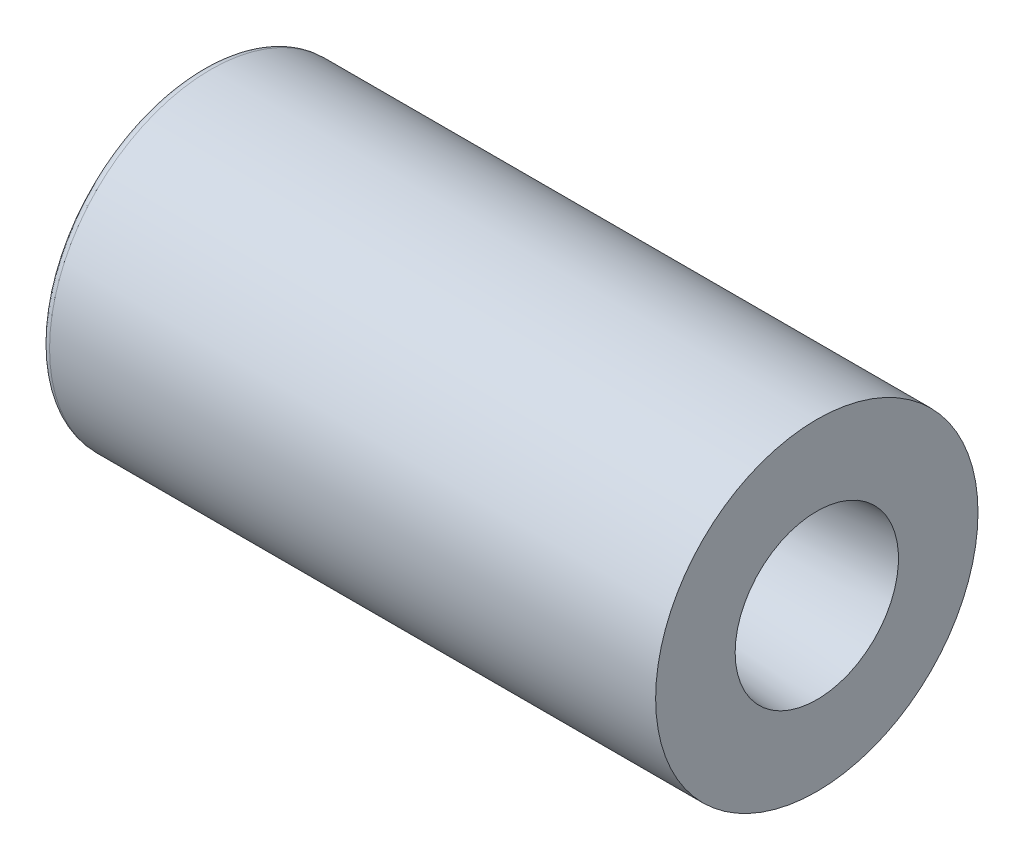
from build123d import *

# Parameters (mm, degrees)
FILLET1_R = 0.508


with BuildPart() as part:
    # Sketch1 → Revolve1 (revolve)
    with BuildSketch(Plane(origin=(0, 0, 0), x_dir=(1, 0, 0), z_dir=(0, 1, 0)), mode=Mode.PRIVATE) as revolve1_sk:
        Polygon((0, 2.286), (0, 5.3848), (1.905, 5.3848), (1.905, 8.001), (0, 8.001), (0, 9.525), (36.323692292, 9.525), (36.323692292, 4.826), align=None)
    revolve(revolve1_sk.sketch.rotate(Axis((0, 0, 0), (1, 0, 0)), 180), axis=Axis((0, 0, 0), (1, 0, 0)))

    # Fillet1
    fillet1_edges = [part.edges().sort_by_distance(p)[0] for p in [
        (0, 0, -9.525),
    ]]
    fillet(fillet1_edges, radius=FILLET1_R)


solid = part.part
